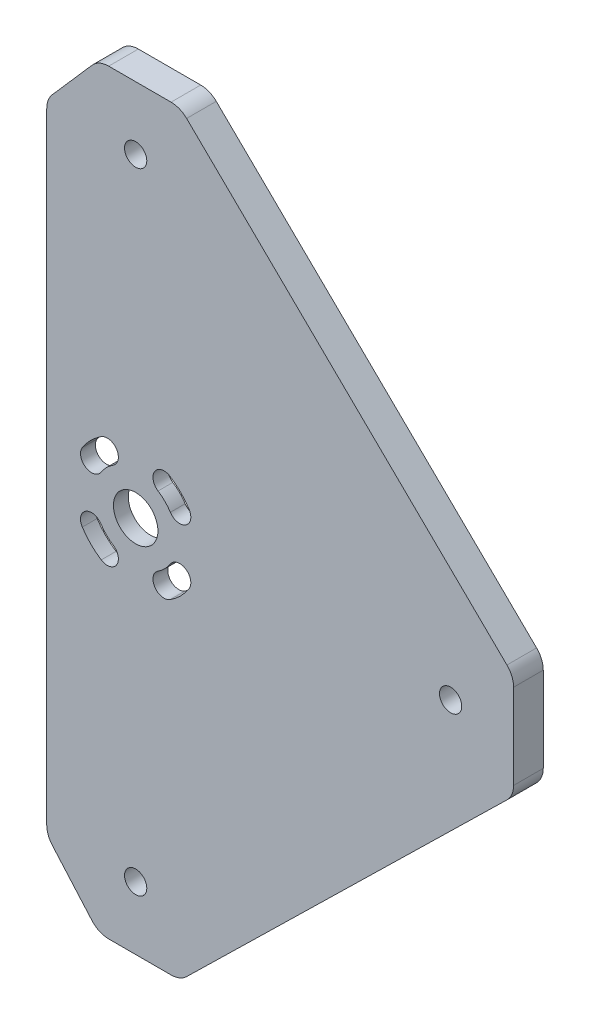
from build123d import *

# Parameters (mm, degrees)
SKETCH_1_R          = 3
SKETCH_1_R_2        = 1.5
EXTRUDE_1_DEPTH     = 4
SKETCH_3_R          = 13
CUT_EXTRUDE_2_DEPTH = 2


with BuildPart() as part:
    # 草图1 → 凸台-拉伸1 (new body)
    with BuildSketch(Plane.XY):
        with BuildLine():
            Line((1789.5396377, 1516.163703518), (1794.90094238, 1510.03649817))
            ThreePointArc((1794.90094238, 1510.03649817), (1795.919023617, 1509.280113251), (1797.158672464, 1509.012011993))
            Line((1797.158672464, 1509.012011993), (1805.574426245, 1509.012011993))
            ThreePointArc((1805.574426245, 1509.012011993), (1806.70688816, 1509.233967715), (1807.671779141, 1509.866991986))
            Line((1807.671779141, 1509.866991986), (1850.89472068, 1552.129423713))
            ThreePointArc((1850.89472068, 1552.129423713), (1851.562513231, 1553.110841273), (1851.797367784, 1554.274443721))
            Line((1851.797367784, 1554.274443721), (1851.797367784, 1565.749580266))
            ThreePointArc((1851.797367784, 1565.749580266), (1851.562513231, 1566.913182714), (1850.89472068, 1567.894600273))
            Line((1850.89472068, 1567.894600273), (1807.671779141, 1610.157032))
            ThreePointArc((1807.671779141, 1610.157032), (1806.70688816, 1610.790056271), (1805.574426245, 1611.012011993))
            Line((1805.574426245, 1611.012011993), (1797.158672464, 1611.012011993))
            ThreePointArc((1797.158672464, 1611.012011993), (1795.919023617, 1610.743910735), (1794.90094238, 1609.987525817))
            Line((1794.90094238, 1609.987525817), (1789.5396377, 1603.860320468))
            ThreePointArc((1789.5396377, 1603.860320468), (1788.989059552, 1602.939986664), (1788.797367784, 1601.884806645))
            Line((1788.797367784, 1601.884806645), (1788.797367784, 1518.139217341))
            ThreePointArc((1788.797367784, 1518.139217341), (1788.989059552, 1517.084037322), (1789.5396377, 1516.163703518))
        make_face()
        with Locations((1800.797367784, 1560.012011993)):
            Circle(SKETCH_1_R, mode=Mode.SUBTRACT)
        with Locations((1800.797367784, 1602.512011993)):
            Circle(SKETCH_1_R_2, mode=Mode.SUBTRACT)
        with Locations((1843.297367784, 1560.012011993)):
            Circle(SKETCH_1_R_2, mode=Mode.SUBTRACT)
        with Locations((1800.797367784, 1517.512011993)):
            Circle(SKETCH_1_R_2, mode=Mode.SUBTRACT)
        with BuildLine():
            ThreePointArc((1805.443255224, 1552.809308797), (1806.858027956, 1553.951351821), (1808.000070981, 1555.366124554))
            ThreePointArc((1808.000070981, 1555.366124554), (1807.55260939, 1557.43971519), (1805.479018754, 1556.992253599))
            ThreePointArc((1805.479018754, 1556.992253599), (1804.736707613, 1556.072672165), (1803.817126178, 1555.330361023))
            ThreePointArc((1803.817126178, 1555.330361023), (1803.369664588, 1553.256770387), (1805.443255224, 1552.809308797))
        make_face(mode=Mode.SUBTRACT)
        with BuildLine():
            ThreePointArc((1808.000070981, 1564.657899433), (1806.858027956, 1566.072672165), (1805.443255224, 1567.21471519))
            ThreePointArc((1805.443255224, 1567.21471519), (1803.369664588, 1566.767253599), (1803.817126178, 1564.693662963))
            ThreePointArc((1803.817126178, 1564.693662963), (1804.736707613, 1563.951351821), (1805.479018754, 1563.031770387))
            ThreePointArc((1805.479018754, 1563.031770387), (1807.55260939, 1562.584308797), (1808.000070981, 1564.657899433))
        make_face(mode=Mode.SUBTRACT)
        with BuildLine():
            ThreePointArc((1796.151480345, 1567.21471519), (1794.736707613, 1566.072672165), (1793.594664588, 1564.657899433))
            ThreePointArc((1793.594664588, 1564.657899433), (1794.042126178, 1562.584308797), (1796.115716814, 1563.031770387))
            ThreePointArc((1796.115716814, 1563.031770387), (1796.858027956, 1563.951351821), (1797.77760939, 1564.693662963))
            ThreePointArc((1797.77760939, 1564.693662963), (1798.225070981, 1566.767253599), (1796.151480345, 1567.21471519))
        make_face(mode=Mode.SUBTRACT)
        with BuildLine():
            ThreePointArc((1793.594664588, 1555.366124554), (1794.736707613, 1553.951351821), (1796.151480345, 1552.809308797))
            ThreePointArc((1796.151480345, 1552.809308797), (1798.225070981, 1553.256770387), (1797.77760939, 1555.330361023))
            ThreePointArc((1797.77760939, 1555.330361023), (1796.858027956, 1556.072672165), (1796.115716814, 1556.992253599))
            ThreePointArc((1796.115716814, 1556.992253599), (1794.042126178, 1557.43971519), (1793.594664588, 1555.366124554))
        make_face(mode=Mode.SUBTRACT)
    extrude(amount=EXTRUDE_1_DEPTH)

    # 草图3 → 切除-拉伸2 (cut)
    with BuildSketch(Plane(origin=(0, 0, 0), x_dir=(-1, 0, 0), z_dir=(0, 0, -1))):
        with Locations((-1800.797367784, 1560.012011993)):
            Circle(SKETCH_3_R)
    extrude(amount=-CUT_EXTRUDE_2_DEPTH, mode=Mode.SUBTRACT)


solid = part.part
